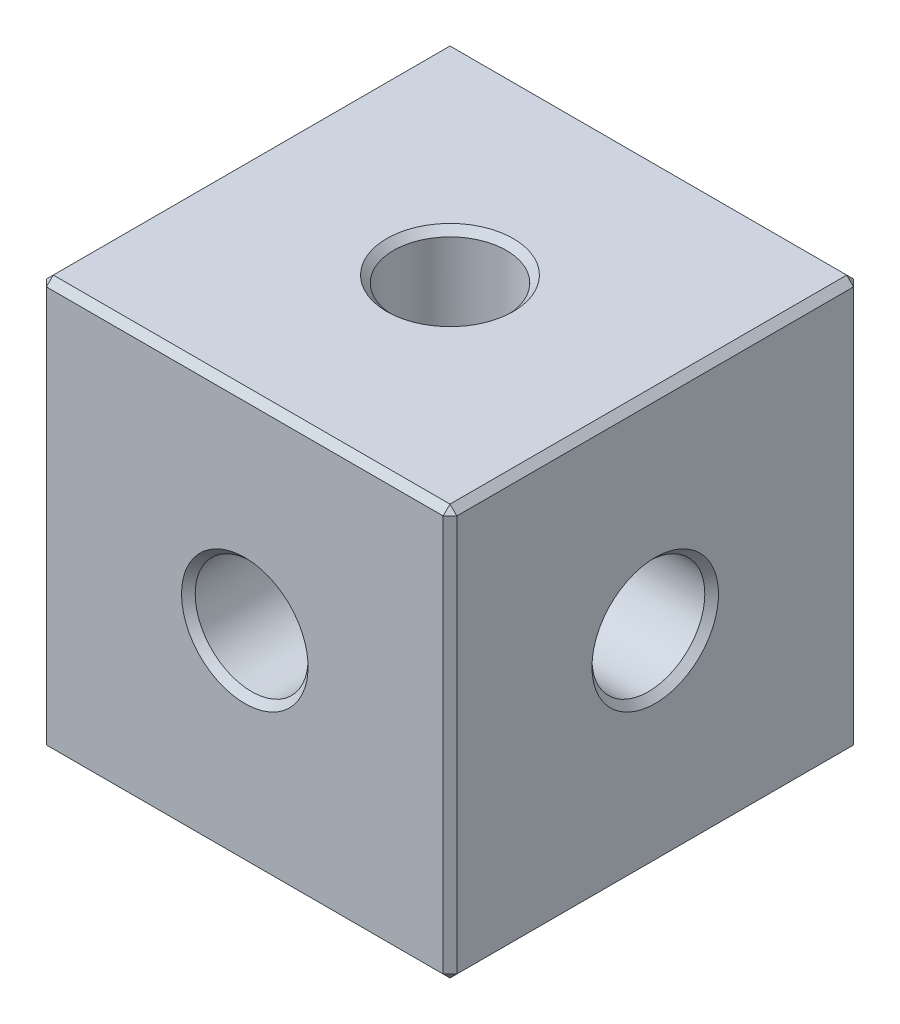
from build123d import *

# Parameters (mm, degrees)
SKETCH_1_W         = 12
SKETCH_1_H         = 12
EXTRUDE_1_DEPTH    = 6
HOLE_WIZARD_M4_1_D = 3.3
HOLE_WIZARD_M4_2_D = 3.3
HOLE_WIZARD_M4_3_D = 3.3
CHAMFER_1_SIZE     = 0.2


with BuildPart() as part:
    # 草图1 → 凸台-拉伸1 (new, symmetric)
    with BuildSketch(Plane(origin=(0, 0, 0), x_dir=(1, 0, 0), z_dir=(0, 1, 0))):
        Rectangle(SKETCH_1_W, SKETCH_1_H)
    extrude(amount=EXTRUDE_1_DEPTH, both=True)

    # M4 螺纹孔1 (through all)
    with Locations(Plane.XY.offset(6)):
        with Locations((0, 0)):
            Hole(HOLE_WIZARD_M4_1_D / 2)

    # M4 螺纹孔2 (through all)
    with Locations(Plane(origin=(0, 6, 0), x_dir=(1, 0, 0), z_dir=(0, 1, 0))):
        with Locations((0, 0)):
            Hole(HOLE_WIZARD_M4_2_D / 2)

    # M4 螺纹孔3 (through all)
    with Locations(Plane(origin=(6, 0, 0), x_dir=(0, 0, -1), z_dir=(1, 0, 0))):
        with Locations((0, 0)):
            Hole(HOLE_WIZARD_M4_3_D / 2)

    # 倒角1
    chamfer_1_edges = [part.edges().sort_by_distance(p)[0] for p in [
        (-6, 6, 0),
        (1.65, 0, 6),
        (1.65, 0, -6),
        (0, 6, 6),
        (1.65, -6, 0),
        (1.65, 6, 0),
        (-6, 0, -1.65),
        (6, 0, -1.65),
        (6, 6, 0),
        (0, -6, 6),
        (-6, -6, 0),
        (0, -6, -6),
        (6, -6, 0),
        (6, 0, 6),
        (-6, 0, 6),
        (-6, 0, -6),
        (6, 0, -6),
        (0, 6, -6),
    ]]
    chamfer(chamfer_1_edges, length=CHAMFER_1_SIZE)


solid = part.part
